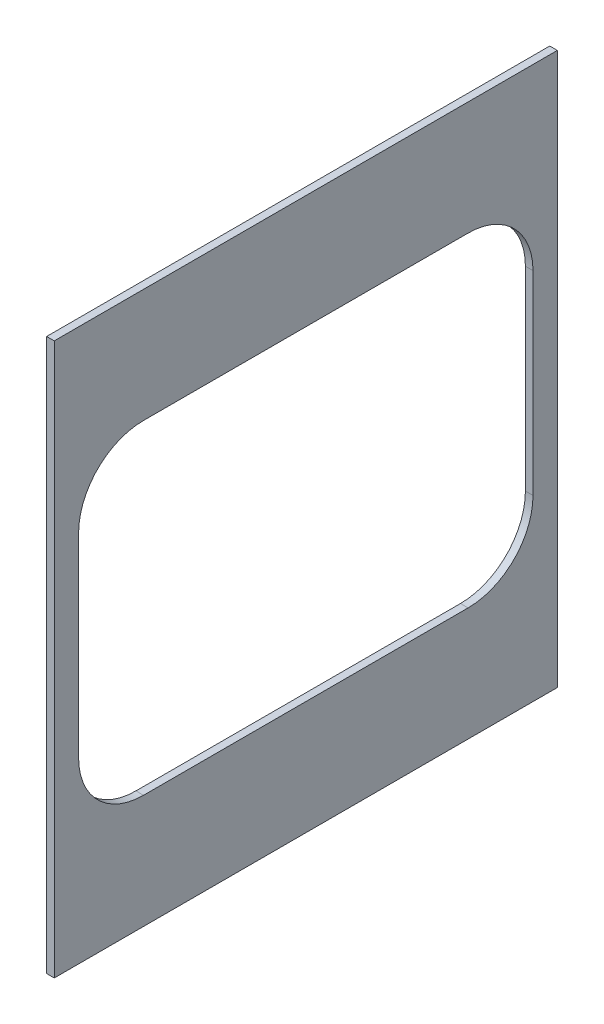
from build123d import *

# Parameters (mm, degrees)
SKETCH1_W           = 787.4
SKETCH1_H           = 863.6
BOSS_EXTRUDE1_DEPTH = 11.90625


with BuildPart() as part:
    # Sketch1 → Boss-Extrude1 (new body)
    with BuildSketch(Plane(origin=(0, 0, 0), x_dir=(0, 0, -1), z_dir=(1, 0, 0))):
        with Locations((393.7, 431.8)):
            Rectangle(SKETCH1_W, SKETCH1_H)
        with BuildLine():
            Line((139.7, 685.8), (647.7, 685.8))
            ThreePointArc((647.7, 685.8), (719.542048969, 656.042048969), (749.3, 584.2))
            Line((749.3, 584.2), (749.3, 279.4))
            ThreePointArc((749.3, 279.4), (719.542048969, 207.557951031), (647.7, 177.8))
            Line((647.7, 177.8), (139.7, 177.8))
            ThreePointArc((139.7, 177.8), (67.857951031, 207.557951031), (38.1, 279.4))
            Line((38.1, 279.4), (38.1, 584.2))
            ThreePointArc((38.1, 584.2), (67.857951031, 656.042048969), (139.7, 685.8))
        make_face(mode=Mode.SUBTRACT)
    extrude(amount=BOSS_EXTRUDE1_DEPTH)


solid = part.part
